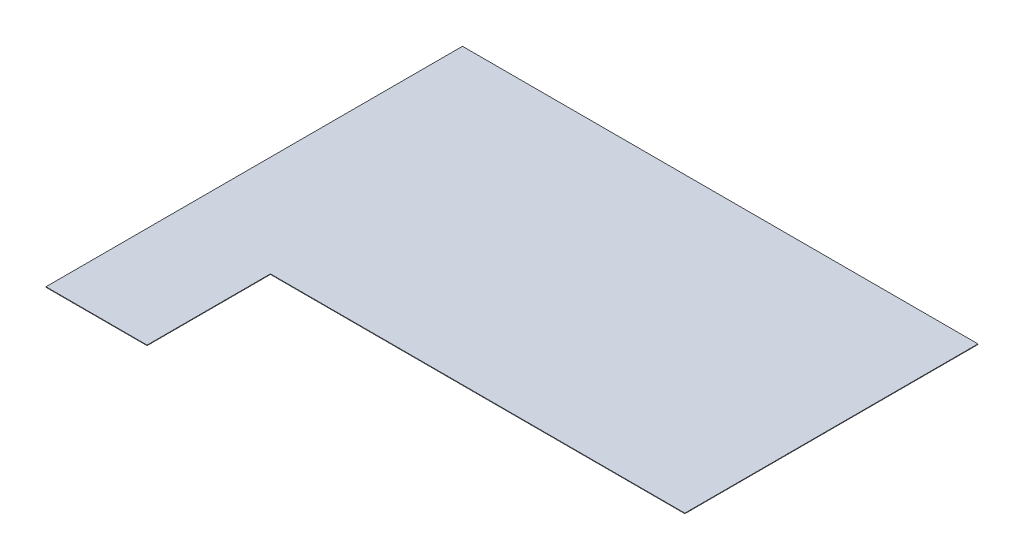
from build123d import *

# Parameters (mm, degrees)
EXTRUDE_1_DEPTH = 5


with BuildPart() as part:
    # Эскиз1 → Бобышка-Вытянуть1 (new body)
    with BuildSketch(Plane(origin=(0, 0, 0), x_dir=(1, 0, 0), z_dir=(0, 1, 0))):
        Polygon((-4100, -4120.282972524), (-4100, -2900), (0, -2900), (0, 0), (-5100, 0), (-5100, -4120.282972524), align=None)
    extrude(amount=EXTRUDE_1_DEPTH)


solid = part.part
